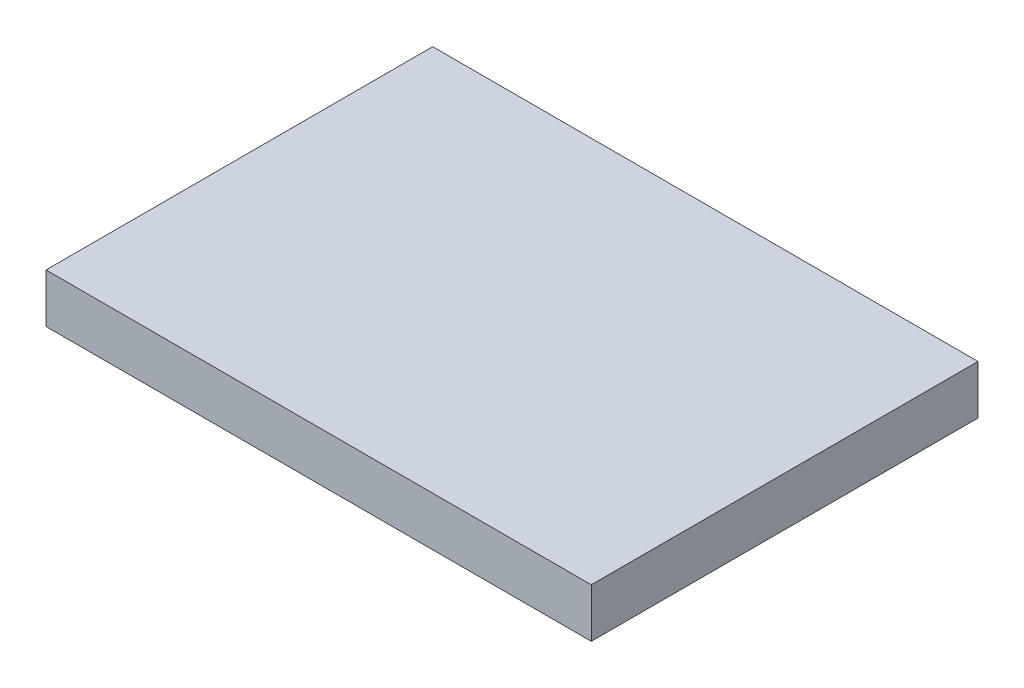
from build123d import *

# Parameters (mm, degrees)
SKETCH1_W           = 42.3
SKETCH1_H           = 3.8
BOSS_EXTRUDE1_DEPTH = 30


with BuildPart() as part:
    # Sketch1 → Boss-Extrude1 (new body)
    with BuildSketch(Plane.XY):
        with Locations((-18.497391233, -9.206761588)):
            Rectangle(SKETCH1_W, SKETCH1_H)
    extrude(amount=BOSS_EXTRUDE1_DEPTH)


solid = part.part
